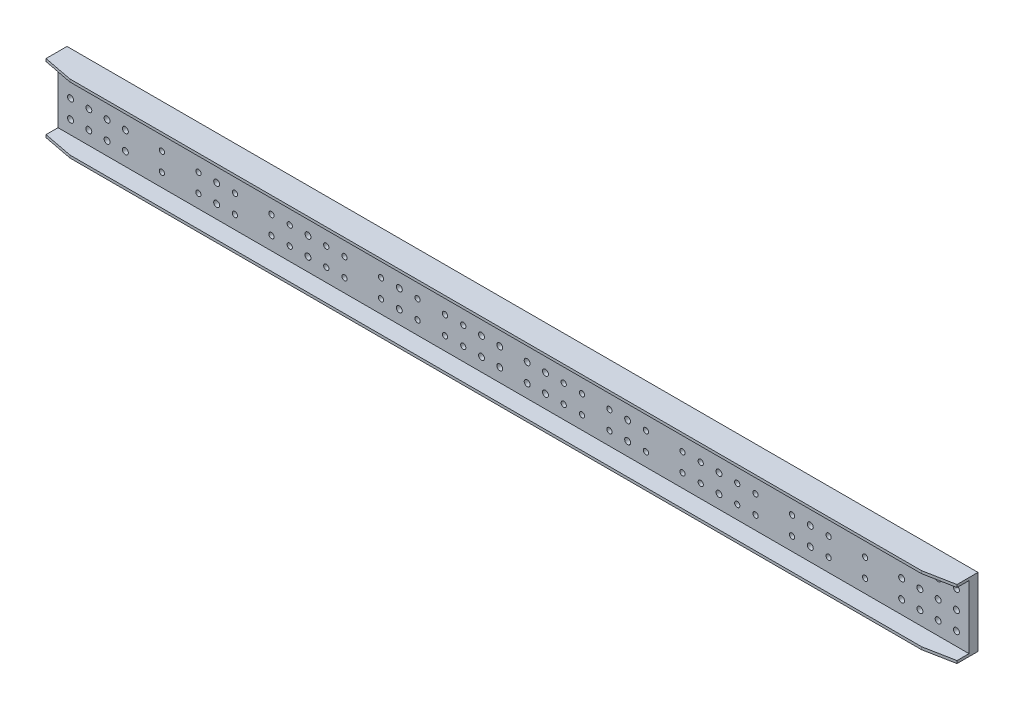
from build123d import *

# Parameters (mm, degrees)
SKETCH_1_W          = 3990
SKETCH_1_H          = 300
SKETCH_1_R          = 13
SKETCH_1_R_2        = 11.5
EXTRUDE_1595_DEPTH  = 39.5
SKETCH_2_W          = 3990
SKETCH_2_H          = 11.5
EXTRUDE_1_DEPTH     = 77.5
SKETCH_3_W          = 70
SKETCH_3_H          = 230
EXTRUDE_2_DEPTH     = 16
SKETCH_4_R          = 13
CUT_EXTRUDE_1_DEPTH = 2003.131676489
CUT_EXTRUDE_2_DEPTH = 2021.820130541


with BuildPart() as part:
    # 草图1 → Extrude 1595 (new body)
    with BuildSketch(Plane.XY):
        Rectangle(SKETCH_1_W, SKETCH_1_H)
        with Locations((1940, 80)):
            Circle(SKETCH_1_R, mode=Mode.SUBTRACT)
        with Locations((1860, 80)):
            Circle(SKETCH_1_R, mode=Mode.SUBTRACT)
        with Locations((1780, 80)):
            Circle(SKETCH_1_R, mode=Mode.SUBTRACT)
        with Locations((1700, 80)):
            Circle(SKETCH_1_R, mode=Mode.SUBTRACT)
        with Locations((1540, 80)):
            Circle(SKETCH_1_R_2, mode=Mode.SUBTRACT)
        with Locations((1380, 80)):
            Circle(SKETCH_1_R_2, mode=Mode.SUBTRACT)
        with Locations((1220, 80)):
            Circle(SKETCH_1_R_2, mode=Mode.SUBTRACT)
        with Locations((1060, 80)):
            Circle(SKETCH_1_R_2, mode=Mode.SUBTRACT)
        with Locations((980, 80)):
            Circle(SKETCH_1_R_2, mode=Mode.SUBTRACT)
        with Locations((820, 80)):
            Circle(SKETCH_1_R_2, mode=Mode.SUBTRACT)
        with Locations((740, 80)):
            Circle(SKETCH_1_R_2, mode=Mode.SUBTRACT)
        with Locations((580, 80)):
            Circle(SKETCH_1_R_2, mode=Mode.SUBTRACT)
        with Locations((980, 0)):
            Circle(SKETCH_1_R_2, mode=Mode.SUBTRACT)
        with Locations((1060, 0)):
            Circle(SKETCH_1_R_2, mode=Mode.SUBTRACT)
        with Locations((820, 0)):
            Circle(SKETCH_1_R_2, mode=Mode.SUBTRACT)
        with Locations((740, 0)):
            Circle(SKETCH_1_R_2, mode=Mode.SUBTRACT)
        with Locations((580, 0)):
            Circle(SKETCH_1_R_2, mode=Mode.SUBTRACT)
        with Locations((1220, 0)):
            Circle(SKETCH_1_R_2, mode=Mode.SUBTRACT)
        with Locations((1380, 0)):
            Circle(SKETCH_1_R_2, mode=Mode.SUBTRACT)
        with Locations((1540, 0)):
            Circle(SKETCH_1_R_2, mode=Mode.SUBTRACT)
        with Locations((1700, 0)):
            Circle(SKETCH_1_R, mode=Mode.SUBTRACT)
        with Locations((1780, 0)):
            Circle(SKETCH_1_R, mode=Mode.SUBTRACT)
        with Locations((1860, 0)):
            Circle(SKETCH_1_R, mode=Mode.SUBTRACT)
        with Locations((1940, 0)):
            Circle(SKETCH_1_R, mode=Mode.SUBTRACT)
        with Locations((420, 80)):
            Circle(SKETCH_1_R_2, mode=Mode.SUBTRACT)
        with Locations((420, 0)):
            Circle(SKETCH_1_R_2, mode=Mode.SUBTRACT)
        with Locations((300, 0)):
            Circle(SKETCH_1_R_2, mode=Mode.SUBTRACT)
        with Locations((300, 80)):
            Circle(SKETCH_1_R_2, mode=Mode.SUBTRACT)
        with Locations((220, 80)):
            Circle(SKETCH_1_R_2, mode=Mode.SUBTRACT)
        with Locations((220, 0)):
            Circle(SKETCH_1_R_2, mode=Mode.SUBTRACT)
        with Locations((140, 0)):
            Circle(SKETCH_1_R, mode=Mode.SUBTRACT)
        with Locations((140, 80)):
            Circle(SKETCH_1_R, mode=Mode.SUBTRACT)
        with Locations((60, 80)):
            Circle(SKETCH_1_R, mode=Mode.SUBTRACT)
        with Locations((60, 0)):
            Circle(SKETCH_1_R, mode=Mode.SUBTRACT)
        with Locations(Location((1700, -80, 0), (0, 0, 180))):
            Circle(SKETCH_1_R, mode=Mode.SUBTRACT)
        with Locations(Location((1780, -80, 0), (0, 0, 180))):
            Circle(SKETCH_1_R, mode=Mode.SUBTRACT)
        with Locations(Location((1860, -80, 0), (0, 0, 180))):
            Circle(SKETCH_1_R, mode=Mode.SUBTRACT)
        with Locations(Location((1940, -80, 0), (0, 0, 180))):
            Circle(SKETCH_1_R, mode=Mode.SUBTRACT)
        with Locations(Location((580, -80, 0), (0, 0, 180))):
            Circle(SKETCH_1_R_2, mode=Mode.SUBTRACT)
        with Locations(Location((740, -80, 0), (0, 0, 180))):
            Circle(SKETCH_1_R_2, mode=Mode.SUBTRACT)
        with Locations(Location((820, -80, 0), (0, 0, 180))):
            Circle(SKETCH_1_R_2, mode=Mode.SUBTRACT)
        with Locations(Location((980, -80, 0), (0, 0, 180))):
            Circle(SKETCH_1_R_2, mode=Mode.SUBTRACT)
        with Locations(Location((1060, -80, 0), (0, 0, 180))):
            Circle(SKETCH_1_R_2, mode=Mode.SUBTRACT)
        with Locations(Location((1220, -80, 0), (0, 0, 180))):
            Circle(SKETCH_1_R_2, mode=Mode.SUBTRACT)
        with Locations(Location((1380, -80, 0), (0, 0, 180))):
            Circle(SKETCH_1_R_2, mode=Mode.SUBTRACT)
        with Locations(Location((1540, -80, 0), (0, 0, 180))):
            Circle(SKETCH_1_R_2, mode=Mode.SUBTRACT)
        with Locations(Location((220, -80, 0), (0, 0, 180))):
            Circle(SKETCH_1_R_2, mode=Mode.SUBTRACT)
        with Locations(Location((300, -80, 0), (0, 0, 180))):
            Circle(SKETCH_1_R_2, mode=Mode.SUBTRACT)
        with Locations(Location((420, -80, 0), (0, 0, 180))):
            Circle(SKETCH_1_R_2, mode=Mode.SUBTRACT)
        with Locations(Location((60, -80, 0), (0, 0, 180))):
            Circle(SKETCH_1_R, mode=Mode.SUBTRACT)
        with Locations(Location((140, -80, 0), (0, 0, 180))):
            Circle(SKETCH_1_R, mode=Mode.SUBTRACT)
        with Locations((-140, -80)):
            Circle(SKETCH_1_R, mode=Mode.SUBTRACT)
        with Locations((-60, -80)):
            Circle(SKETCH_1_R, mode=Mode.SUBTRACT)
        with Locations((-580, -80)):
            Circle(SKETCH_1_R_2, mode=Mode.SUBTRACT)
        with Locations((-420, -80)):
            Circle(SKETCH_1_R_2, mode=Mode.SUBTRACT)
        with Locations((-300, -80)):
            Circle(SKETCH_1_R_2, mode=Mode.SUBTRACT)
        with Locations((-220, -80)):
            Circle(SKETCH_1_R_2, mode=Mode.SUBTRACT)
        with Locations((-1540, -80)):
            Circle(SKETCH_1_R_2, mode=Mode.SUBTRACT)
        with Locations((-1380, -80)):
            Circle(SKETCH_1_R_2, mode=Mode.SUBTRACT)
        with Locations((-1220, -80)):
            Circle(SKETCH_1_R_2, mode=Mode.SUBTRACT)
        with Locations((-1060, -80)):
            Circle(SKETCH_1_R_2, mode=Mode.SUBTRACT)
        with Locations((-980, -80)):
            Circle(SKETCH_1_R_2, mode=Mode.SUBTRACT)
        with Locations((-820, -80)):
            Circle(SKETCH_1_R_2, mode=Mode.SUBTRACT)
        with Locations((-740, -80)):
            Circle(SKETCH_1_R_2, mode=Mode.SUBTRACT)
        with Locations((-1940, -80)):
            Circle(SKETCH_1_R, mode=Mode.SUBTRACT)
        with Locations((-1860, -80)):
            Circle(SKETCH_1_R, mode=Mode.SUBTRACT)
        with Locations((-1780, -80)):
            Circle(SKETCH_1_R, mode=Mode.SUBTRACT)
        with Locations((-1700, -80)):
            Circle(SKETCH_1_R, mode=Mode.SUBTRACT)
        with Locations(Location((-60, 0, 0), (0, 0, 180))):
            Circle(SKETCH_1_R, mode=Mode.SUBTRACT)
        with Locations(Location((-60, 80, 0), (0, 0, 180))):
            Circle(SKETCH_1_R, mode=Mode.SUBTRACT)
        with Locations(Location((-140, 80, 0), (0, 0, 180))):
            Circle(SKETCH_1_R, mode=Mode.SUBTRACT)
        with Locations(Location((-140, 0, 0), (0, 0, 180))):
            Circle(SKETCH_1_R, mode=Mode.SUBTRACT)
        with Locations(Location((-220, 0, 0), (0, 0, 180))):
            Circle(SKETCH_1_R_2, mode=Mode.SUBTRACT)
        with Locations(Location((-220, 80, 0), (0, 0, 180))):
            Circle(SKETCH_1_R_2, mode=Mode.SUBTRACT)
        with Locations(Location((-300, 80, 0), (0, 0, 180))):
            Circle(SKETCH_1_R_2, mode=Mode.SUBTRACT)
        with Locations(Location((-300, 0, 0), (0, 0, 180))):
            Circle(SKETCH_1_R_2, mode=Mode.SUBTRACT)
        with Locations(Location((-420, 0, 0), (0, 0, 180))):
            Circle(SKETCH_1_R_2, mode=Mode.SUBTRACT)
        with Locations(Location((-420, 80, 0), (0, 0, 180))):
            Circle(SKETCH_1_R_2, mode=Mode.SUBTRACT)
        with Locations(Location((-1940, 0, 0), (0, 0, 180))):
            Circle(SKETCH_1_R, mode=Mode.SUBTRACT)
        with Locations(Location((-1860, 0, 0), (0, 0, 180))):
            Circle(SKETCH_1_R, mode=Mode.SUBTRACT)
        with Locations(Location((-1780, 0, 0), (0, 0, 180))):
            Circle(SKETCH_1_R, mode=Mode.SUBTRACT)
        with Locations(Location((-1700, 0, 0), (0, 0, 180))):
            Circle(SKETCH_1_R, mode=Mode.SUBTRACT)
        with Locations(Location((-1540, 0, 0), (0, 0, 180))):
            Circle(SKETCH_1_R_2, mode=Mode.SUBTRACT)
        with Locations(Location((-1380, 0, 0), (0, 0, 180))):
            Circle(SKETCH_1_R_2, mode=Mode.SUBTRACT)
        with Locations(Location((-1220, 0, 0), (0, 0, 180))):
            Circle(SKETCH_1_R_2, mode=Mode.SUBTRACT)
        with Locations(Location((-580, 0, 0), (0, 0, 180))):
            Circle(SKETCH_1_R_2, mode=Mode.SUBTRACT)
        with Locations(Location((-740, 0, 0), (0, 0, 180))):
            Circle(SKETCH_1_R_2, mode=Mode.SUBTRACT)
        with Locations(Location((-820, 0, 0), (0, 0, 180))):
            Circle(SKETCH_1_R_2, mode=Mode.SUBTRACT)
        with Locations(Location((-1060, 0, 0), (0, 0, 180))):
            Circle(SKETCH_1_R_2, mode=Mode.SUBTRACT)
        with Locations(Location((-980, 0, 0), (0, 0, 180))):
            Circle(SKETCH_1_R_2, mode=Mode.SUBTRACT)
        with Locations(Location((-580, 80, 0), (0, 0, 180))):
            Circle(SKETCH_1_R_2, mode=Mode.SUBTRACT)
        with Locations(Location((-740, 80, 0), (0, 0, 180))):
            Circle(SKETCH_1_R_2, mode=Mode.SUBTRACT)
        with Locations(Location((-820, 80, 0), (0, 0, 180))):
            Circle(SKETCH_1_R_2, mode=Mode.SUBTRACT)
        with Locations(Location((-980, 80, 0), (0, 0, 180))):
            Circle(SKETCH_1_R_2, mode=Mode.SUBTRACT)
        with Locations(Location((-1060, 80, 0), (0, 0, 180))):
            Circle(SKETCH_1_R_2, mode=Mode.SUBTRACT)
        with Locations(Location((-1220, 80, 0), (0, 0, 180))):
            Circle(SKETCH_1_R_2, mode=Mode.SUBTRACT)
        with Locations(Location((-1380, 80, 0), (0, 0, 180))):
            Circle(SKETCH_1_R_2, mode=Mode.SUBTRACT)
        with Locations(Location((-1540, 80, 0), (0, 0, 180))):
            Circle(SKETCH_1_R_2, mode=Mode.SUBTRACT)
        with Locations(Location((-1700, 80, 0), (0, 0, 180))):
            Circle(SKETCH_1_R, mode=Mode.SUBTRACT)
        with Locations(Location((-1780, 80, 0), (0, 0, 180))):
            Circle(SKETCH_1_R, mode=Mode.SUBTRACT)
        with Locations(Location((-1860, 80, 0), (0, 0, 180))):
            Circle(SKETCH_1_R, mode=Mode.SUBTRACT)
        with Locations(Location((-1940, 80, 0), (0, 0, 180))):
            Circle(SKETCH_1_R, mode=Mode.SUBTRACT)
    extrude(amount=EXTRUDE_1595_DEPTH)

    # 草图2 → 凸台-拉伸1 (add)
    with BuildSketch(Plane.XY.offset(39.5)):
        with Locations((0, 144.25)):
            Rectangle(SKETCH_2_W, SKETCH_2_H)
        with Locations((0, -144.25)):
            Rectangle(SKETCH_2_W, SKETCH_2_H)
    extrude(amount=EXTRUDE_1_DEPTH)

    # 草图3 → 凸台-拉伸2 (add)
    with BuildSketch(Plane(origin=(0, 0, 0), x_dir=(-1, 0, 0), z_dir=(0, 0, -1))):
        with Locations((1300, 0)):
            Rectangle(SKETCH_3_W, SKETCH_3_H)
        with Locations((900, 0)):
            Rectangle(SKETCH_3_W, SKETCH_3_H)
        with Locations((-1300, 0)):
            Rectangle(SKETCH_3_W, SKETCH_3_H)
        with Locations((500, 0)):
            Rectangle(SKETCH_3_W, SKETCH_3_H)
        with Locations((-900, 0)):
            Rectangle(SKETCH_3_W, SKETCH_3_H)
        with Locations((-500, 0)):
            Rectangle(SKETCH_3_W, SKETCH_3_H)
    extrude(amount=EXTRUDE_2_DEPTH)

    # 草图4 → 切除-拉伸1 (cut, through all)
    with BuildSketch(Plane.XY.offset(39.5)):
        with Locations((1300, 80)):
            Circle(SKETCH_4_R)
        with Locations((900, 80)):
            Circle(SKETCH_4_R)
        with Locations((900, 0)):
            Circle(SKETCH_4_R)
        with Locations((1300, 0)):
            Circle(SKETCH_4_R)
        with Locations(Location((900, -80, 0), (0, 0, 180))):
            Circle(SKETCH_4_R)
        with Locations(Location((1300, -80, 0), (0, 0, 180))):
            Circle(SKETCH_4_R)
        with Locations((500, 80)):
            Circle(SKETCH_4_R)
        with Locations((500, 0)):
            Circle(SKETCH_4_R)
        with Locations(Location((500, -80, 0), (0, 0, 180))):
            Circle(SKETCH_4_R)
        with Locations((-500, -80)):
            Circle(SKETCH_4_R)
        with Locations(Location((-500, 0, 0), (0, 0, 180))):
            Circle(SKETCH_4_R)
        with Locations(Location((-500, 80, 0), (0, 0, 180))):
            Circle(SKETCH_4_R)
        with Locations((-1300, -80)):
            Circle(SKETCH_4_R)
        with Locations((-900, -80)):
            Circle(SKETCH_4_R)
        with Locations(Location((-1300, 0, 0), (0, 0, 180))):
            Circle(SKETCH_4_R)
        with Locations(Location((-900, 0, 0), (0, 0, 180))):
            Circle(SKETCH_4_R)
        with Locations(Location((-900, 80, 0), (0, 0, 180))):
            Circle(SKETCH_4_R)
        with Locations(Location((-1300, 80, 0), (0, 0, 180))):
            Circle(SKETCH_4_R)
    extrude(amount=-CUT_EXTRUDE_1_DEPTH, mode=Mode.SUBTRACT)

    # 草图5 → 切除-拉伸2 (cut, through all)
    with BuildSketch(Plane(origin=(0, 150, 0), x_dir=(-1, 0, 0), z_dir=(0, 1, 0))):
        Polygon((-1995, 92), (-1995, 117), (-1865, 117), align=None)
        Polygon((1865, 117), (1995, 92), (1995, 117), align=None)
    extrude(amount=-CUT_EXTRUDE_2_DEPTH, mode=Mode.SUBTRACT)


solid = part.part
